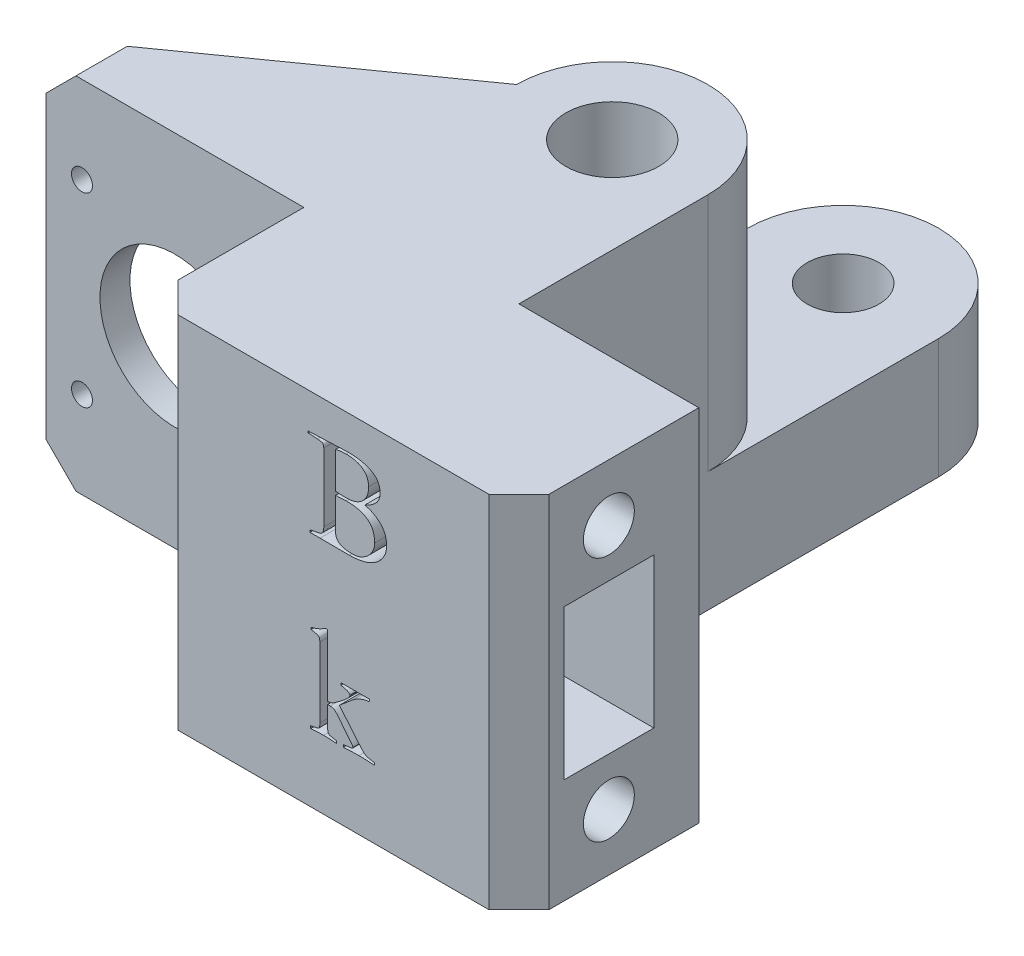
from build123d import *

# Parameters (mm, degrees)
SKETCH_1_R          = 6
SKETCH_1_R_2        = 7.75
EXTRUDE_1_DEPTH     = 60
CUT_EXTRUDE_START   = -40
SKETCH_3_R          = 15.93293451
CUT_EXTRUDE_1_DEPTH = 40
CUT_EXTRUDE_2_DEPTH = 40
SKETCH_5_R          = 4.25
CUT_EXTRUDE_3_DEPTH = 108.890486757
SKETCH_6_W          = 30
SKETCH_6_H          = 60
SKETCH_6_R          = 4.25
EXTRUDE_2_DEPTH     = 30
SKETCH_7_W          = 15
SKETCH_7_H          = 25
CUT_EXTRUDE_4_DEPTH = 121.217757731
SKETCH_8_W          = 5
SKETCH_8_H          = 60
EXTRUDE_3_DEPTH     = 43
SKETCH_9_R          = 12.5
SKETCH_9_R_2        = 1.75
CUT_EXTRUDE_5_DEPTH = 175.035428991
EXTRUDE_4_DEPTH     = 5
EXTRUDE_5_DEPTH     = 5
CHAMFER_1_SIZE      = 5
CHAMFER_2_SIZE      = 5
CUT_EXTRUDE_6_DEPTH = 5


with BuildPart() as part:
    # 草图1 → 凸台-拉伸1 (new body)
    with BuildSketch(Plane(origin=(0, 0, 0), x_dir=(1, 0, 0), z_dir=(0, 1, 0))):
        with BuildLine():
            Line((74.517406475, 16.185183146), (74.517406475, -83.814816854))
            Line((74.517406475, -83.814816854), (106.383275494, -83.814816854))
            Line((106.383275494, -83.814816854), (106.383275494, 16.185183146))
            ThreePointArc((106.383275494, 16.185183146), (90.450340985, 32.118117656), (74.517406475, 16.185183146))
        make_face()
        with Locations(Location((90.450340985, 16.185183146, 0), (0, 0, 270))):
            Circle(SKETCH_1_R, mode=Mode.SUBTRACT)
        with Locations(Location((90.450340985, -22.314816854, 0), (0, 0, 270))):
            Circle(SKETCH_1_R_2, mode=Mode.SUBTRACT)
    extrude(amount=EXTRUDE_1_DEPTH)

    # 草图3 → 切除-拉伸1 (cut)
    with BuildSketch(Plane(origin=(0, 60, 0), x_dir=(1, 0, 0), z_dir=(0, 1, 0)).offset(CUT_EXTRUDE_START)):
        with Locations((90.450340985, 16.185183146)):
            Circle(SKETCH_3_R)
    extrude(amount=CUT_EXTRUDE_1_DEPTH, mode=Mode.SUBTRACT)

    # 草图4 → 切除-拉伸2 (cut)
    with BuildSketch(Plane(origin=(0, 60, 0), x_dir=(1, 0, 0), z_dir=(0, 1, 0))):
        with BuildLine():
            Line((74.517406475, 16.185183146), (74.517406475, -22.314816854))
            ThreePointArc((74.517406475, -22.314816854), (90.450340985, -6.381882344), (106.383275494, -22.314816854))
            Line((106.383275494, -22.314816854), (106.383275494, 16.185183146))
            Line((106.383275494, 16.185183146), (74.517406475, 16.185183146))
        make_face()
    extrude(amount=-CUT_EXTRUDE_2_DEPTH, mode=Mode.SUBTRACT)

    # 草图5 → 切除-拉伸3 (cut, through all)
    with BuildSketch(Plane.ZY.offset(-74.517406475)):
        with Locations((68.814816854, 9.5)):
            Circle(SKETCH_5_R)
        with Locations((68.814816854, 50.5)):
            Circle(SKETCH_5_R)
    extrude(amount=-CUT_EXTRUDE_3_DEPTH, mode=Mode.SUBTRACT)

    # 草图6 → 凸台-拉伸2 (add)
    with BuildSketch(Plane(origin=(106.383275494, 0, 0), x_dir=(0, 0, -1), z_dir=(1, 0, 0))):
        with Locations((-68.814816854, 30)):
            Rectangle(SKETCH_6_W, SKETCH_6_H)
        with Locations(Location((-68.814816854, 50.5, 0), (0, 0, 180))):
            Circle(SKETCH_6_R, mode=Mode.SUBTRACT)
        with Locations(Location((-68.814816854, 9.5, 0), (0, 0, 180))):
            Circle(SKETCH_6_R, mode=Mode.SUBTRACT)
    extrude(amount=EXTRUDE_2_DEPTH)

    # 草图7 → 切除-拉伸4 (cut, through all)
    with BuildSketch(Plane.ZY.offset(-74.517406475)):
        with Locations((68.814816854, 30)):
            Rectangle(SKETCH_7_W, SKETCH_7_H)
    extrude(amount=-CUT_EXTRUDE_4_DEPTH, mode=Mode.SUBTRACT)

    # 草图8 → 凸台-拉伸3 (add)
    with BuildSketch(Plane.ZY.offset(-74.517406475)):
        with Locations((55.314816854, 30)):
            Rectangle(SKETCH_8_W, SKETCH_8_H)
    extrude(amount=EXTRUDE_3_DEPTH)

    # 草图9 → 切除-拉伸5 (cut, through all)
    with BuildSketch(Plane.XY.offset(57.814816854)):
        with Locations((53.017406475, 30)):
            Circle(SKETCH_9_R)
        with Locations((68.517406475, 45.5)):
            Circle(SKETCH_9_R_2)
        with Locations((37.517406475, 45.5)):
            Circle(SKETCH_9_R_2)
        with Locations((37.517406475, 14.5)):
            Circle(SKETCH_9_R_2)
        with Locations((68.517406475, 14.5)):
            Circle(SKETCH_9_R_2)
    extrude(amount=-CUT_EXTRUDE_5_DEPTH, mode=Mode.SUBTRACT)

    # 草图10 → 凸台-拉伸4 (add)
    with BuildSketch(Plane(origin=(0, 60, 0), x_dir=(1, 0, 0), z_dir=(0, 1, 0))):
        Polygon((31.517406475, -52.814816854), (74.517406475, -52.814816854), (74.517406475, -22.314816854), align=None)
    extrude(amount=-EXTRUDE_4_DEPTH)

    # 草图12 → 凸台-拉伸5 (add)
    with BuildSketch(Plane.XZ):
        Polygon((31.517406475, 52.814816854), (74.517406475, 22.314816854), (74.517406475, 52.814816854), align=None)
    extrude(amount=-EXTRUDE_5_DEPTH)

    # 倒角1
    chamfer_1_edges = [part.edges().sort_by_distance(p)[0] for p in [
        (136.383275494, 30, 83.814816854),
        (74.517406475, 30, 83.814816854),
    ]]
    chamfer(chamfer_1_edges, length=CHAMFER_1_SIZE)

    # 倒角2
    chamfer_2_edges = [part.edges().sort_by_distance(p)[0] for p in [
        (31.517406475, 0, 55.314816854),
        (31.517406475, 60, 55.314816854),
    ]]
    chamfer(chamfer_2_edges, length=CHAMFER_2_SIZE)

    # 草图13 → 切除-拉伸6 (cut)
    # profile 1 of 2: a face of its own
    with BuildSketch(Plane.XY.offset(83.814816854)):
        with BuildLine():
            Line((101.248358902, 53.796352011), (101.248358902, 54.079242264))
            Line((101.248358902, 54.079242264), (102.638951949, 54.130367008))
            add(Edge.make_bspline(
                [(102.638951949, 54.130367008), (102.818444121, 54.139713627), (103.168307453, 54.157931912), (103.67855007, 54.180207526), (104.160120153, 54.205841056), (104.61355913, 54.224594857), (105.038334549, 54.246698832), (105.433829153, 54.26199371), (105.800654483, 54.281021732), (106.138213933, 54.29259735), (106.448239137, 54.308318833), (106.728977098, 54.316614643), (106.981085446, 54.328663598), (107.203856397, 54.333810458), (107.398045659, 54.342475945), (107.563987538, 54.344161448), (107.701413264, 54.349261376), (107.783234174, 54.348733723), (107.819592712, 54.348499251)],
                knots=[0, 0, 0, 0, 1.663739314, 3.242934638, 4.727590698, 6.127710919, 7.443789893, 8.664839365, 9.7913353, 10.843828658, 11.791250134, 12.664691591, 13.443553602, 14.127451153, 14.727261893, 15.242678856, 15.663471241, 16, 16, 16, 16], degree=3))
            add(Edge.make_bspline(
                [(107.819592712, 54.348499251), (108.033241969, 54.345828543), (108.447248218, 54.340653286), (109.04882826, 54.302398742), (109.612265796, 54.242973809), (110.137317784, 54.155515495), (110.622330681, 54.039873958), (111.067783554, 53.900097266), (111.476235204, 53.737855567), (111.844500714, 53.546576981), (112.176595345, 53.333553439), (112.459932922, 53.085893851), (112.704229543, 52.814557736), (112.898541828, 52.51050397), (113.054063238, 52.181083604), (113.162915473, 51.821817288), (113.228470122, 51.435673543), (113.235313055, 51.168804615), (113.238815616, 51.032207499)],
                knots=[0, 0, 0, 0, 1.430311445, 2.77163556, 4.034123986, 5.222074067, 6.332700705, 7.369534221, 8.345546662, 9.2708952, 10.144297946, 10.980058916, 11.782912912, 12.580416415, 13.386865512, 14.214522406, 15.086101589, 16, 16, 16, 16], degree=3))
            add(Edge.make_bspline(
                [(113.238815616, 51.032207499), (113.230943706, 50.885920334), (113.215300306, 50.595212165), (113.088514951, 50.171409794), (112.889194629, 49.768352477), (112.605875442, 49.388483414), (112.242324167, 49.032386275), (111.798354208, 48.701144884), (111.279966824, 48.384154378), (110.897034792, 48.20515438), (110.696211663, 48.111280437)],
                knots=[0, 0, 0, 0, 0.854033442, 1.697172126, 2.564663413, 3.472133214, 4.453883382, 5.530071056, 6.704681726, 8, 8, 8, 8], degree=3))
            add(Edge.make_bspline(
                [(110.696211663, 48.111280437), (110.843262844, 48.06852855), (111.129405337, 47.985338933), (111.541279751, 47.837248764), (111.925803611, 47.675510842), (112.281590389, 47.494996308), (112.607201782, 47.296286119), (112.905286227, 47.081569502), (113.174343443, 46.848937012), (113.418981256, 46.604084458), (113.63104881, 46.339160879), (113.816379615, 46.058690854), (113.972519529, 45.761338814), (114.104689892, 45.44876331), (114.202690811, 45.11816076), (114.268753507, 44.770830958), (114.316460706, 44.40888562), (114.320566825, 44.161205725), (114.322660197, 44.034934152)],
                knots=[0, 0, 0, 0, 1.237844011, 2.408683614, 3.536358565, 4.60850064, 5.630856783, 6.617475503, 7.574887686, 8.503673861, 9.411699338, 10.313525024, 11.217453144, 12.123245996, 13.053166914, 13.998875869, 14.979791667, 16, 16, 16, 16], degree=3))
            add(Edge.make_bspline(
                [(114.322660197, 44.034934152), (114.319720659, 43.930319204), (114.313855133, 43.72157155), (114.276420373, 43.411102962), (114.210879817, 43.108214119), (114.122204533, 42.809675617), (114.001764929, 42.520662329), (113.862500785, 42.234224495), (113.693040068, 41.957166523), (113.435767004, 41.595478779), (113.058131248, 41.17480077), (112.525854619, 40.738685456), (111.92053092, 40.367959772), (111.244561493, 40.07248765), (110.515081136, 39.841800594), (109.742956623, 39.68098514), (108.934558183, 39.57900823), (108.383412522, 39.566295026), (108.102482965, 39.559814861)],
                knots=[0, 0, 0, 0, 0.588454334, 1.174196081, 1.755739912, 2.329863534, 2.92318992, 3.514758706, 4.119705681, 4.747411266, 6.009909577, 7.285472113, 8.60501478, 9.989611784, 11.424494025, 12.900894324, 14.420326153, 16, 16, 16, 16], degree=3))
            Line((108.102482965, 39.559814861), (103.204732453, 39.583673075))
            Line((103.204732453, 39.583673075), (101.531249154, 39.583673075))
            Line((101.531249154, 39.583673075), (101.531249154, 39.961996183))
            Line((101.531249154, 39.961996183), (103.013866741, 40.244886435))
            add(Edge.make_bspline(
                [(103.013866741, 40.244886435), (103.083740671, 40.261054904), (103.216174571, 40.291699428), (103.395777544, 40.366082933), (103.541451089, 40.462227803), (103.661872206, 40.581567766), (103.744179811, 40.745734967), (103.798861316, 40.956477191), (103.836107544, 41.218390543), (103.837775334, 41.411514463), (103.838679284, 41.516188412)],
                knots=[0, 0, 0, 0, 1.010706419, 1.915618498, 2.724615552, 3.461326251, 4.278693825, 5.278155626, 6.524749292, 8, 8, 8, 8], degree=3))
            Line((103.838679284, 41.516188412), (103.838679284, 52.917006408))
            add(Edge.make_bspline(
                [(103.838679284, 52.917006408), (103.837941908, 52.976167081), (103.83658721, 53.084856447), (103.812984669, 53.235510077), (103.773222188, 53.359250933), (103.712049133, 53.470230197), (103.585592095, 53.556137173), (103.387579766, 53.612112052), (103.110901642, 53.660814703), (102.898215216, 53.682126206), (102.778692917, 53.694102523)],
                knots=[0, 0, 0, 0, 0.9208203, 1.69172139, 2.36319941, 2.942828824, 3.625864974, 4.672266516, 6.1299307, 8, 8, 8, 8], degree=3))
            Line((102.778692917, 53.694102523), (101.248358902, 53.796352011))
        make_face()
        with BuildLine():
            add(Edge.make_bspline(
                [(105.801869468, 47.661382686), (105.840468661, 47.655525573), (105.928806286, 47.642121057), (106.077515481, 47.62431651), (106.258598479, 47.616964974), (106.470987566, 47.606000583), (106.716356459, 47.595327938), (106.99474899, 47.589080153), (107.306064164, 47.585611031), (107.524204386, 47.586127861), (107.638951949, 47.586399728)],
                knots=[0, 0, 0, 0, 0.509216822, 1.165387155, 1.951976914, 2.871742801, 3.93953552, 5.154939866, 6.503422652, 8, 8, 8, 8], degree=3))
            add(Edge.make_bspline(
                [(107.638951949, 47.586399728), (107.775402552, 47.588635878), (108.041119851, 47.592990449), (108.429012953, 47.63790851), (108.795576513, 47.714185383), (109.142817783, 47.813269957), (109.46768419, 47.94899532), (109.770856044, 48.11296859), (110.056249763, 48.303205404), (110.314442229, 48.526572304), (110.549651197, 48.770821881), (110.757486622, 49.037587225), (110.92526818, 49.330217126), (111.072039721, 49.637372181), (111.179498695, 49.967745021), (111.259092882, 50.31662418), (111.301968262, 50.686909255), (111.309341919, 50.940084325), (111.313116911, 51.069698978)],
                knots=[0, 0, 0, 0, 1.145471495, 2.230635733, 3.2728013, 4.287128272, 5.258038078, 6.22274092, 7.177962423, 8.132039833, 9.083442344, 10.022277383, 10.963097737, 11.910617837, 12.876028025, 13.873570906, 14.911360548, 16, 16, 16, 16], degree=3))
            add(Edge.make_bspline(
                [(111.313116911, 51.069698978), (111.311266019, 51.178979376), (111.307641531, 51.392976357), (111.256879413, 51.703218397), (111.183875849, 51.995429889), (111.076935246, 52.267879597), (110.938911437, 52.520603814), (110.77584578, 52.759402804), (110.575837626, 52.973282672), (110.348113986, 53.1692533), (110.094561806, 53.346278548), (109.810627869, 53.496001068), (109.503222152, 53.626384313), (109.167464497, 53.731219072), (108.804948641, 53.812959977), (108.415088503, 53.868515409), (107.999930622, 53.90871188), (107.714039546, 53.91104029), (107.567377307, 53.912234765)],
                knots=[0, 0, 0, 0, 0.98414051, 1.92718092, 2.826488459, 3.695720586, 4.557315494, 5.418240444, 6.295342348, 7.188563133, 8.123335019, 9.076500174, 10.077132264, 11.129927624, 12.243121812, 13.423687049, 14.678350396, 16, 16, 16, 16], degree=3))
            add(Edge.make_bspline(
                [(107.567377307, 53.912234765), (107.416193442, 53.909559196), (107.11554328, 53.904238454), (106.668961273, 53.863268503), (106.231026844, 53.791032534), (105.944686764, 53.724085334), (105.801869468, 53.690694206)],
                knots=[0, 0, 0, 0, 1.016903345, 2.022253877, 3.013563329, 4, 4, 4, 4], degree=3))
            Line((105.801869468, 53.690694206), (105.801869468, 47.661382686))
        make_face(mode=Mode.SUBTRACT)
        with BuildLine():
            Line((105.801869468, 47.054702386), (105.801869468, 41.778628767))
            add(Edge.make_bspline(
                [(105.801869468, 41.778628767), (105.80320696, 41.705714528), (105.805793666, 41.564698594), (105.843497927, 41.362138569), (105.891542205, 41.170138991), (105.971943953, 40.99547498), (106.067296804, 40.8309041), (106.188570616, 40.684376563), (106.329327889, 40.550515595), (106.491621186, 40.430118433), (106.675604909, 40.324377652), (106.882978161, 40.237868996), (107.108208164, 40.156608132), (107.35823788, 40.099247637), (107.627057129, 40.045598225), (107.91895017, 40.013771576), (108.231680744, 39.992780294), (108.447818887, 39.990458936), (108.559197348, 39.989262713)],
                knots=[0, 0, 0, 0, 0.938700201, 1.815443571, 2.650684968, 3.483739022, 4.285276232, 5.097587096, 5.926637612, 6.785197265, 7.697456421, 8.655508634, 9.6795149, 10.781079124, 11.959195466, 13.213127925, 14.563892907, 16, 16, 16, 16], degree=3))
            add(Edge.make_bspline(
                [(108.559197348, 39.989262713), (108.68318245, 39.992724727), (108.92753314, 39.999547686), (109.28835707, 40.048142337), (109.63783379, 40.12984861), (109.975126148, 40.24669816), (110.301567039, 40.392851103), (110.612397893, 40.576393304), (110.914561777, 40.788101865), (111.199327226, 41.031472549), (111.46482259, 41.293094559), (111.692279244, 41.574159861), (111.889045587, 41.861625026), (112.051025277, 42.15890622), (112.174105428, 42.468290319), (112.262656942, 42.787034561), (112.320161073, 43.116022339), (112.325899589, 43.339399167), (112.328795166, 43.452112066)],
                knots=[0, 0, 0, 0, 1.051908267, 2.073108042, 3.083281839, 4.092397067, 5.097682972, 6.112904228, 7.150669594, 8.224568306, 9.287987585, 10.308823263, 11.28745417, 12.240732993, 13.175205295, 14.106140275, 15.044384228, 16, 16, 16, 16], degree=3))
            add(Edge.make_bspline(
                [(112.328795166, 43.452112066), (112.325973891, 43.604519653), (112.320501202, 43.900158756), (112.265608939, 44.327276945), (112.173869173, 44.723915168), (112.044034377, 45.089533149), (111.880575926, 45.427235889), (111.677877715, 45.733495045), (111.437145428, 46.007300308), (111.161957647, 46.252209009), (110.847292936, 46.464841613), (110.494440961, 46.648134946), (110.103758355, 46.804476387), (109.676327597, 46.93391232), (109.209943338, 47.032633473), (108.704851749, 47.096856292), (108.161317155, 47.14438387), (107.78562535, 47.148174105), (107.591235521, 47.150135242)],
                knots=[0, 0, 0, 0, 1.062163949, 2.060377725, 2.99607205, 3.895490159, 4.759868844, 5.6056834, 6.447706213, 7.294966068, 8.167185001, 9.088383609, 10.062129435, 11.097006293, 12.198492808, 13.381469028, 14.645124055, 16, 16, 16, 16], degree=3))
            add(Edge.make_bspline(
                [(107.591235521, 47.150135242), (107.304761222, 47.145541339), (106.70714295, 47.13595793), (106.11181895, 47.082522834), (105.801869468, 47.054702386)],
                knots=[0, 0, 0, 0, 0.958720014, 2, 2, 2, 2], degree=3))
        make_face(mode=Mode.SUBTRACT)
    # profile 2 of 2: a face of its own
    with BuildSketch(Plane.XY.offset(83.814816854)):
        with BuildLine():
            add(Edge.make_bspline(
                [(112.274262106, 11.307940287), (112.108514778, 11.325466898), (111.74474348, 11.363933147), (111.146273168, 11.38855522), (110.449852467, 11.410915986), (109.952091955, 11.412666861), (109.68735004, 11.413598092)],
                knots=[0, 0, 0, 0, 0.771948473, 1.69422157, 2.773634745, 4, 4, 4, 4], degree=3))
            add(Edge.make_bspline(
                [(109.68735004, 11.413598092), (109.421471781, 11.412682305), (108.922574753, 11.410963911), (108.223884907, 11.388477936), (107.62314847, 11.363911226), (107.257097305, 11.325467118), (107.090213026, 11.307940287)],
                knots=[0, 0, 0, 0, 1.226795107, 2.30197247, 3.225862045, 4, 4, 4, 4], degree=3))
            Line((107.090213026, 11.307940287), (107.090213026, 11.733979823))
            Line((107.090213026, 11.733979823), (108.184282556, 11.839637628))
            add(Edge.make_bspline(
                [(108.184282556, 11.839637628), (108.260996704, 11.848791805), (108.396083879, 11.86491154), (108.564307963, 11.912500926), (108.68370234, 11.990037921), (108.701200903, 12.064697402), (108.709163265, 12.098669666)],
                knots=[0, 0, 0, 0, 1.467635509, 2.584382932, 3.355852517, 4, 4, 4, 4], degree=3))
            add(Edge.make_bspline(
                [(108.709163265, 12.098669666), (108.706817869, 12.123892426), (108.7014311, 12.181822614), (108.664207444, 12.272863904), (108.604206097, 12.375003826), (108.521165332, 12.4961194), (108.408803181, 12.645408704), (108.261878591, 12.832634497), (108.076736349, 13.062193382), (107.854503229, 13.329952446), (107.605145348, 13.631925936), (107.339771619, 13.963848371), (107.056814894, 14.317364171), (106.770065143, 14.681705325), (106.505769724, 15.031696405), (106.264709152, 15.322113418), (106.077345767, 15.554507583), (105.884375153, 15.757626746), (105.694566639, 15.945490844), (105.466638097, 16.106461152), (105.206642887, 16.190748846), (105.023164297, 16.198197046), (104.922523864, 16.202282482)],
                knots=[0, 0, 0, 0, 0.263858218, 0.606014432, 1.015782482, 1.503588461, 2.140552595, 2.970193064, 3.992802268, 5.225261501, 6.609889408, 8.089048633, 9.670278947, 11.346242452, 12.938819059, 14.256557129, 15.294245835, 16.059330388, 17.185828253, 18.085611985, 18.94993286, 20, 20, 20, 20], degree=3))
            Line((104.922523864, 16.202282482), (104.493076012, 16.202282482))
            Line((104.493076012, 16.202282482), (104.493076012, 12.828049353))
            add(Edge.make_bspline(
                [(104.493076012, 12.828049353), (104.493479428, 12.73819762), (104.494206433, 12.576274116), (104.519529655, 12.361010708), (104.547754134, 12.197717582), (104.59963243, 12.076977383), (104.686326453, 12.00048885), (104.79141355, 11.938481362), (104.92662568, 11.88825467), (105.027841374, 11.865569496), (105.08271473, 11.853270893)],
                knots=[0, 0, 0, 0, 1.656865502, 2.985868621, 3.993340658, 4.715384184, 5.353048186, 6.08656782, 6.962646585, 8, 8, 8, 8], degree=3))
            Line((105.08271473, 11.853270893), (105.975693599, 11.689671711))
            Line((105.975693599, 11.689671711), (105.975693599, 11.307940287))
            add(Edge.make_bspline(
                [(105.975693599, 11.307940287), (105.839450782, 11.322593373), (105.539083002, 11.354898307), (105.043297372, 11.383550583), (104.460235962, 11.399175203), (104.042054007, 11.401909603), (103.818229386, 11.403373143)],
                knots=[0, 0, 0, 0, 0.760920929, 1.677564641, 2.756956855, 4, 4, 4, 4], degree=3))
            add(Edge.make_bspline(
                [(103.818229386, 11.403373143), (103.593267842, 11.401930356), (103.173948207, 11.399241057), (102.588625828, 11.383414498), (102.091684302, 11.355062541), (101.790190609, 11.322606745), (101.653948541, 11.307940287)],
                knots=[0, 0, 0, 0, 1.245427173, 2.321428176, 3.241469715, 4, 4, 4, 4], degree=3))
            Line((101.653948541, 11.307940287), (101.653948541, 11.723754874))
            Line((101.653948541, 11.723754874), (102.523069195, 11.88394574))
            add(Edge.make_bspline(
                [(102.523069195, 11.88394574), (102.588419701, 11.891605752), (102.707487993, 11.905562254), (102.862063563, 11.959516239), (102.985785679, 12.017296376), (103.074492176, 12.108408853), (103.123900255, 12.237249762), (103.159801954, 12.404703574), (103.182290401, 12.623011914), (103.183574787, 12.785967881), (103.184282556, 12.875765781)],
                knots=[0, 0, 0, 0, 1.135205665, 2.068338974, 2.825142751, 3.47907623, 4.210129918, 5.178872309, 6.445400032, 8, 8, 8, 8], degree=3))
            Line((103.184282556, 12.875765781), (103.184282556, 24.600373825))
            add(Edge.make_bspline(
                [(103.184282556, 24.600373825), (103.180950682, 24.68348194), (103.174867777, 24.835210052), (103.133916859, 25.042964373), (103.055488957, 25.206714768), (102.93354467, 25.334952554), (102.743187564, 25.419491661), (102.483290361, 25.497335744), (102.133327755, 25.575033831), (101.868975614, 25.614549217), (101.722114866, 25.636501977)],
                knots=[0, 0, 0, 0, 0.97407012, 1.778331973, 2.462974506, 3.074903155, 3.807197195, 4.86817496, 6.26011559, 8, 8, 8, 8], degree=3))
            Line((101.722114866, 25.636501977), (101.722114866, 25.967108658))
            add(Edge.make_bspline(
                [(101.722114866, 25.967108658), (101.924624249, 26.013420394), (102.336989854, 26.107724012), (102.942935028, 26.344402067), (103.552582457, 26.647480862), (103.944274138, 26.898291168), (104.14542775, 27.027095024)],
                knots=[0, 0, 0, 0, 0.935375041, 1.904684567, 2.923948892, 4, 4, 4, 4], degree=3))
            Line((104.14542775, 27.027095024), (104.493076012, 27.027095024))
            Line((104.493076012, 27.027095024), (104.493076012, 16.638546967))
            add(Edge.make_bspline(
                [(104.493076012, 16.638546967), (104.574086386, 16.641478261), (104.736823562, 16.647366772), (104.979198555, 16.707253152), (105.221331474, 16.794491152), (105.468063551, 16.925046188), (105.734111207, 17.09400421), (106.035740811, 17.302004032), (106.378808011, 17.551909369), (106.742059885, 17.837192219), (107.099925648, 18.122124969), (107.415635992, 18.383471645), (107.666603382, 18.611355151), (107.864698064, 18.802163251), (108.012279773, 18.967772632), (108.115926412, 19.114290396), (108.1862163, 19.245758344), (108.196629165, 19.332780101), (108.201324137, 19.372016633)],
                knots=[0, 0, 0, 0, 0.817225145, 1.641677538, 2.509824449, 3.413608833, 4.455418027, 5.69428001, 7.115842778, 8.744192015, 10.361615473, 11.739093853, 12.885260535, 13.786488652, 14.518806469, 15.120806479, 15.603587577, 16, 16, 16, 16], degree=3))
            add(Edge.make_bspline(
                [(108.201324137, 19.372016633), (108.196202103, 19.410507171), (108.185268543, 19.492669566), (108.104841555, 19.603688386), (107.983367277, 19.703499046), (107.815025144, 19.794583366), (107.600771208, 19.877778577), (107.339424547, 19.949462406), (107.03452613, 20.023912618), (106.813352105, 20.058829722), (106.694848336, 20.077538105)],
                knots=[0, 0, 0, 0, 0.523357126, 1.117164824, 1.810456592, 2.66486048, 3.71639251, 4.943871812, 6.362544123, 8, 8, 8, 8], degree=3))
            Line((106.694848336, 20.077538105), (106.694848336, 20.452452898))
            Line((106.694848336, 20.452452898), (111.473307777, 20.452452898))
            Line((111.473307777, 20.452452898), (111.473307777, 20.077538105))
            add(Edge.make_bspline(
                [(111.473307777, 20.077538105), (111.335462682, 20.061728401), (111.062496723, 20.030421438), (110.663163169, 19.942441024), (110.275092221, 19.8309386), (109.899925455, 19.68613187), (109.534879022, 19.516394023), (109.181631102, 19.317087308), (108.840420255, 19.089731559), (108.62610049, 18.916985625), (108.518297552, 18.830094343)],
                knots=[0, 0, 0, 0, 1.021722009, 2.02325174, 3.008699526, 3.99436062, 4.983038635, 5.972566821, 6.980200201, 8, 8, 8, 8], degree=3))
            Line((108.518297552, 18.830094343), (106.446041247, 17.061178187))
            Line((106.446041247, 17.061178187), (109.639633612, 13.220005726))
            add(Edge.make_bspline(
                [(109.639633612, 13.220005726), (109.741997, 13.098660823), (109.929925662, 12.87588405), (110.199257806, 12.585859551), (110.417278458, 12.355609365), (110.643417408, 12.148250553), (110.903081342, 11.966145175), (111.128955594, 11.907839975), (111.234725637, 11.880537424)],
                knots=[0, 0, 0, 0, 1.346601675, 2.472222293, 3.358382743, 4.034008194, 5.079385834, 6, 6, 6, 6], degree=3))
            Line((111.234725637, 11.880537424), (112.274262106, 11.689671711))
            Line((112.274262106, 11.689671711), (112.274262106, 11.307940287))
        make_face()
    extrude(amount=-CUT_EXTRUDE_6_DEPTH, mode=Mode.SUBTRACT)


solid = part.part
